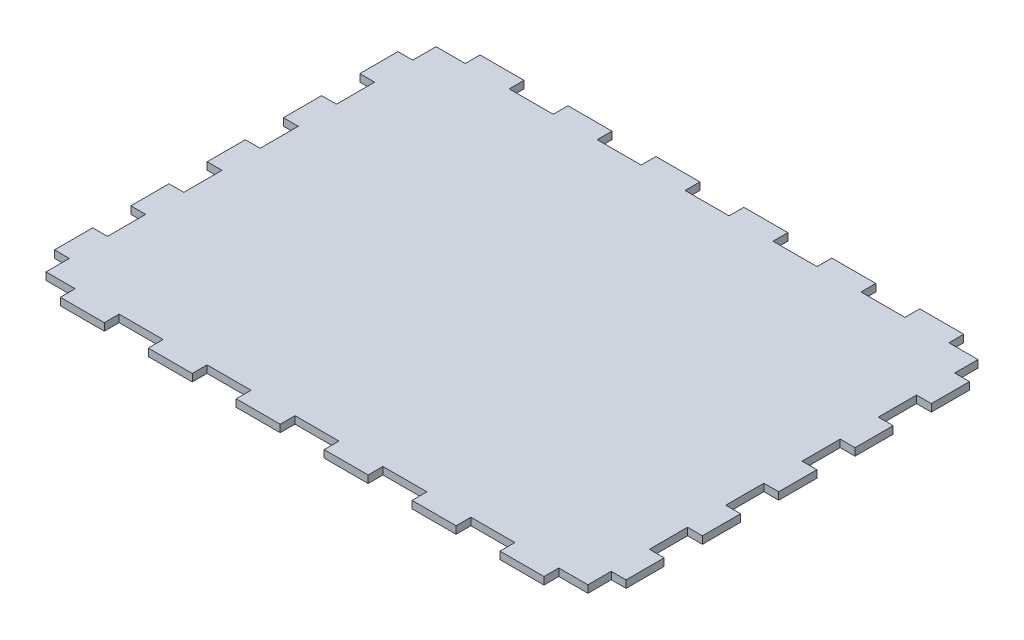
from build123d import *

# Parameters (mm, degrees)
ESBO_O1_W                = 231.5
ESBO_O1_H                = 170
RESSALTO_EXTRUS_O1_DEPTH = 3
CORTE_EXTRUS_O1_REACH    = 145.639
ESBO_O2_W                = 17.807692308
ESBO_O2_H                = 6
CORTE_EXTRUS_O2_REACH    = 145.639
ESBO_O3_W                = 6
ESBO_O3_H                = 15.454545455


with BuildPart() as part:
    # Esboço1 → Ressalto-extrusão1 (new body)
    with BuildSketch(Plane(origin=(0, 0, 0), x_dir=(1, 0, 0), z_dir=(0, 1, 0))):
        Rectangle(ESBO_O1_W, ESBO_O1_H)
    extrude(amount=RESSALTO_EXTRUS_O1_DEPTH)

    # Esboço2 → Corte-extrusão1 (cut, up to next)
    with BuildSketch(Plane.XZ, mode=Mode.PRIVATE) as corte_extrus_o1_sk1:
        with Locations((-71.226153846, 82)):
            Rectangle(ESBO_O2_W, ESBO_O2_H)
    corte_extrus_o1_tool1 = extrude(corte_extrus_o1_sk1.sketch, amount=-CORTE_EXTRUS_O1_REACH, mode=Mode.PRIVATE) & part.part
    # Esboço2 → Corte-extrusão1 (cut, up to next)
    with BuildSketch(Plane.XZ, mode=Mode.PRIVATE) as corte_extrus_o1_sk2:
        with Locations((-106.846153846, 82)):
            Rectangle(ESBO_O2_W, ESBO_O2_H)
    corte_extrus_o1_tool2 = extrude(corte_extrus_o1_sk2.sketch, amount=-CORTE_EXTRUS_O1_REACH, mode=Mode.PRIVATE) & part.part
    # Esboço2 → Corte-extrusão1 (cut, up to next)
    with BuildSketch(Plane.XZ, mode=Mode.PRIVATE) as corte_extrus_o1_sk3:
        with Locations((-35.606153846, 82)):
            Rectangle(ESBO_O2_W, ESBO_O2_H)
    corte_extrus_o1_tool3 = extrude(corte_extrus_o1_sk3.sketch, amount=-CORTE_EXTRUS_O1_REACH, mode=Mode.PRIVATE) & part.part
    # Esboço2 → Corte-extrusão1 (cut, up to next)
    with BuildSketch(Plane.XZ, mode=Mode.PRIVATE) as corte_extrus_o1_sk4:
        with Locations((0.013846154, 82)):
            Rectangle(ESBO_O2_W, ESBO_O2_H)
    corte_extrus_o1_tool4 = extrude(corte_extrus_o1_sk4.sketch, amount=-CORTE_EXTRUS_O1_REACH, mode=Mode.PRIVATE) & part.part
    # Esboço2 → Corte-extrusão1 (cut, up to next)
    with BuildSketch(Plane.XZ, mode=Mode.PRIVATE) as corte_extrus_o1_sk5:
        with Locations((35.633846154, 82)):
            Rectangle(ESBO_O2_W, ESBO_O2_H)
    corte_extrus_o1_tool5 = extrude(corte_extrus_o1_sk5.sketch, amount=-CORTE_EXTRUS_O1_REACH, mode=Mode.PRIVATE) & part.part
    # Esboço2 → Corte-extrusão1 (cut, up to next)
    with BuildSketch(Plane.XZ, mode=Mode.PRIVATE) as corte_extrus_o1_sk6:
        with Locations((71.253846154, 82)):
            Rectangle(ESBO_O2_W, ESBO_O2_H)
    corte_extrus_o1_tool6 = extrude(corte_extrus_o1_sk6.sketch, amount=-CORTE_EXTRUS_O1_REACH, mode=Mode.PRIVATE) & part.part
    # Esboço2 → Corte-extrusão1 (cut, up to next)
    with BuildSketch(Plane.XZ, mode=Mode.PRIVATE) as corte_extrus_o1_sk7:
        with Locations((106.873846154, 82)):
            Rectangle(ESBO_O2_W, ESBO_O2_H)
    corte_extrus_o1_tool7 = extrude(corte_extrus_o1_sk7.sketch, amount=-CORTE_EXTRUS_O1_REACH, mode=Mode.PRIVATE) & part.part
    # Esboço2 → Corte-extrusão1 (cut, up to next)
    with BuildSketch(Plane.XZ, mode=Mode.PRIVATE) as corte_extrus_o1_sk8:
        with Locations((-71.226153846, -82)):
            Rectangle(ESBO_O2_W, ESBO_O2_H)
    corte_extrus_o1_tool8 = extrude(corte_extrus_o1_sk8.sketch, amount=-CORTE_EXTRUS_O1_REACH, mode=Mode.PRIVATE) & part.part
    # Esboço2 → Corte-extrusão1 (cut, up to next)
    with BuildSketch(Plane.XZ, mode=Mode.PRIVATE) as corte_extrus_o1_sk9:
        with Locations((-35.606153846, -82)):
            Rectangle(ESBO_O2_W, ESBO_O2_H)
    corte_extrus_o1_tool9 = extrude(corte_extrus_o1_sk9.sketch, amount=-CORTE_EXTRUS_O1_REACH, mode=Mode.PRIVATE) & part.part
    # Esboço2 → Corte-extrusão1 (cut, up to next)
    with BuildSketch(Plane.XZ, mode=Mode.PRIVATE) as corte_extrus_o1_sk10:
        with Locations((0.013846154, -82)):
            Rectangle(ESBO_O2_W, ESBO_O2_H)
    corte_extrus_o1_tool10 = extrude(corte_extrus_o1_sk10.sketch, amount=-CORTE_EXTRUS_O1_REACH, mode=Mode.PRIVATE) & part.part
    # Esboço2 → Corte-extrusão1 (cut, up to next)
    with BuildSketch(Plane.XZ, mode=Mode.PRIVATE) as corte_extrus_o1_sk11:
        with Locations((35.633846154, -82)):
            Rectangle(ESBO_O2_W, ESBO_O2_H)
    corte_extrus_o1_tool11 = extrude(corte_extrus_o1_sk11.sketch, amount=-CORTE_EXTRUS_O1_REACH, mode=Mode.PRIVATE) & part.part
    # Esboço2 → Corte-extrusão1 (cut, up to next)
    with BuildSketch(Plane.XZ, mode=Mode.PRIVATE) as corte_extrus_o1_sk12:
        with Locations((71.253846154, -82)):
            Rectangle(ESBO_O2_W, ESBO_O2_H)
    corte_extrus_o1_tool12 = extrude(corte_extrus_o1_sk12.sketch, amount=-CORTE_EXTRUS_O1_REACH, mode=Mode.PRIVATE) & part.part
    # Esboço2 → Corte-extrusão1 (cut, up to next)
    with BuildSketch(Plane.XZ, mode=Mode.PRIVATE) as corte_extrus_o1_sk13:
        with Locations((106.873846154, -82)):
            Rectangle(ESBO_O2_W, ESBO_O2_H)
    corte_extrus_o1_tool13 = extrude(corte_extrus_o1_sk13.sketch, amount=-CORTE_EXTRUS_O1_REACH, mode=Mode.PRIVATE) & part.part
    # Esboço2 → Corte-extrusão1 (cut, up to next)
    with BuildSketch(Plane.XZ, mode=Mode.PRIVATE) as corte_extrus_o1_sk14:
        with Locations((-106.846153846, -82)):
            Rectangle(ESBO_O2_W, ESBO_O2_H)
    corte_extrus_o1_tool14 = extrude(corte_extrus_o1_sk14.sketch, amount=-CORTE_EXTRUS_O1_REACH, mode=Mode.PRIVATE) & part.part
    add(corte_extrus_o1_tool1.solids().sort_by_distance((-71.226154, 0, 82))[0], mode=Mode.SUBTRACT)
    add(corte_extrus_o1_tool2.solids().sort_by_distance((-106.846154, 0, 82))[0], mode=Mode.SUBTRACT)
    add(corte_extrus_o1_tool3.solids().sort_by_distance((-35.606154, 0, 82))[0], mode=Mode.SUBTRACT)
    add(corte_extrus_o1_tool4.solids().sort_by_distance((0.013846, 0, 82))[0], mode=Mode.SUBTRACT)
    add(corte_extrus_o1_tool5.solids().sort_by_distance((35.633846, 0, 82))[0], mode=Mode.SUBTRACT)
    add(corte_extrus_o1_tool6.solids().sort_by_distance((71.253846, 0, 82))[0], mode=Mode.SUBTRACT)
    add(corte_extrus_o1_tool7.solids().sort_by_distance((106.873846, 0, 82))[0], mode=Mode.SUBTRACT)
    add(corte_extrus_o1_tool8.solids().sort_by_distance((-71.226154, 0, -82))[0], mode=Mode.SUBTRACT)
    add(corte_extrus_o1_tool9.solids().sort_by_distance((-35.606154, 0, -82))[0], mode=Mode.SUBTRACT)
    add(corte_extrus_o1_tool10.solids().sort_by_distance((0.013846, 0, -82))[0], mode=Mode.SUBTRACT)
    add(corte_extrus_o1_tool11.solids().sort_by_distance((35.633846, 0, -82))[0], mode=Mode.SUBTRACT)
    add(corte_extrus_o1_tool12.solids().sort_by_distance((71.253846, 0, -82))[0], mode=Mode.SUBTRACT)
    add(corte_extrus_o1_tool13.solids().sort_by_distance((106.873846, 0, -82))[0], mode=Mode.SUBTRACT)
    add(corte_extrus_o1_tool14.solids().sort_by_distance((-106.846154, 0, -82))[0], mode=Mode.SUBTRACT)

    # Esboço3 → Corte-extrusão2 (cut, up to next)
    with BuildSketch(Plane.XZ, mode=Mode.PRIVATE) as corte_extrus_o2_sk1:
        with Locations((112.75, 77.272727272)):
            Rectangle(ESBO_O3_W, ESBO_O3_H)
    corte_extrus_o2_tool1 = extrude(corte_extrus_o2_sk1.sketch, amount=-CORTE_EXTRUS_O2_REACH, mode=Mode.PRIVATE) & part.part
    # Esboço3 → Corte-extrusão2 (cut, up to next)
    with BuildSketch(Plane.XZ, mode=Mode.PRIVATE) as corte_extrus_o2_sk2:
        with Locations((-112.75, 77.272727272)):
            Rectangle(ESBO_O3_W, ESBO_O3_H)
    corte_extrus_o2_tool2 = extrude(corte_extrus_o2_sk2.sketch, amount=-CORTE_EXTRUS_O2_REACH, mode=Mode.PRIVATE) & part.part
    # Esboço3 → Corte-extrusão2 (cut, up to next)
    with BuildSketch(Plane.XZ, mode=Mode.PRIVATE) as corte_extrus_o2_sk3:
        with Locations((112.75, 46.362727273)):
            Rectangle(ESBO_O3_W, ESBO_O3_H)
    corte_extrus_o2_tool3 = extrude(corte_extrus_o2_sk3.sketch, amount=-CORTE_EXTRUS_O2_REACH, mode=Mode.PRIVATE) & part.part
    # Esboço3 → Corte-extrusão2 (cut, up to next)
    with BuildSketch(Plane.XZ, mode=Mode.PRIVATE) as corte_extrus_o2_sk4:
        with Locations((112.75, 15.452727273)):
            Rectangle(ESBO_O3_W, ESBO_O3_H)
    corte_extrus_o2_tool4 = extrude(corte_extrus_o2_sk4.sketch, amount=-CORTE_EXTRUS_O2_REACH, mode=Mode.PRIVATE) & part.part
    # Esboço3 → Corte-extrusão2 (cut, up to next)
    with BuildSketch(Plane.XZ, mode=Mode.PRIVATE) as corte_extrus_o2_sk5:
        with Locations((112.75, -15.457272728)):
            Rectangle(ESBO_O3_W, ESBO_O3_H)
    corte_extrus_o2_tool5 = extrude(corte_extrus_o2_sk5.sketch, amount=-CORTE_EXTRUS_O2_REACH, mode=Mode.PRIVATE) & part.part
    # Esboço3 → Corte-extrusão2 (cut, up to next)
    with BuildSketch(Plane.XZ, mode=Mode.PRIVATE) as corte_extrus_o2_sk6:
        with Locations((112.75, -46.367272728)):
            Rectangle(ESBO_O3_W, ESBO_O3_H)
    corte_extrus_o2_tool6 = extrude(corte_extrus_o2_sk6.sketch, amount=-CORTE_EXTRUS_O2_REACH, mode=Mode.PRIVATE) & part.part
    # Esboço3 → Corte-extrusão2 (cut, up to next)
    with BuildSketch(Plane.XZ, mode=Mode.PRIVATE) as corte_extrus_o2_sk7:
        with Locations((112.75, -77.277272728)):
            Rectangle(ESBO_O3_W, ESBO_O3_H)
    corte_extrus_o2_tool7 = extrude(corte_extrus_o2_sk7.sketch, amount=-CORTE_EXTRUS_O2_REACH, mode=Mode.PRIVATE) & part.part
    # Esboço3 → Corte-extrusão2 (cut, up to next)
    with BuildSketch(Plane.XZ, mode=Mode.PRIVATE) as corte_extrus_o2_sk8:
        with Locations((-112.75, 46.362727273)):
            Rectangle(ESBO_O3_W, ESBO_O3_H)
    corte_extrus_o2_tool8 = extrude(corte_extrus_o2_sk8.sketch, amount=-CORTE_EXTRUS_O2_REACH, mode=Mode.PRIVATE) & part.part
    # Esboço3 → Corte-extrusão2 (cut, up to next)
    with BuildSketch(Plane.XZ, mode=Mode.PRIVATE) as corte_extrus_o2_sk9:
        with Locations((-112.75, 15.452727273)):
            Rectangle(ESBO_O3_W, ESBO_O3_H)
    corte_extrus_o2_tool9 = extrude(corte_extrus_o2_sk9.sketch, amount=-CORTE_EXTRUS_O2_REACH, mode=Mode.PRIVATE) & part.part
    # Esboço3 → Corte-extrusão2 (cut, up to next)
    with BuildSketch(Plane.XZ, mode=Mode.PRIVATE) as corte_extrus_o2_sk10:
        with Locations((-112.75, -15.457272728)):
            Rectangle(ESBO_O3_W, ESBO_O3_H)
    corte_extrus_o2_tool10 = extrude(corte_extrus_o2_sk10.sketch, amount=-CORTE_EXTRUS_O2_REACH, mode=Mode.PRIVATE) & part.part
    # Esboço3 → Corte-extrusão2 (cut, up to next)
    with BuildSketch(Plane.XZ, mode=Mode.PRIVATE) as corte_extrus_o2_sk11:
        with Locations((-112.75, -46.367272728)):
            Rectangle(ESBO_O3_W, ESBO_O3_H)
    corte_extrus_o2_tool11 = extrude(corte_extrus_o2_sk11.sketch, amount=-CORTE_EXTRUS_O2_REACH, mode=Mode.PRIVATE) & part.part
    # Esboço3 → Corte-extrusão2 (cut, up to next)
    with BuildSketch(Plane.XZ, mode=Mode.PRIVATE) as corte_extrus_o2_sk12:
        with Locations((-112.75, -77.277272728)):
            Rectangle(ESBO_O3_W, ESBO_O3_H)
    corte_extrus_o2_tool12 = extrude(corte_extrus_o2_sk12.sketch, amount=-CORTE_EXTRUS_O2_REACH, mode=Mode.PRIVATE) & part.part
    add(corte_extrus_o2_tool1.solids().sort_by_distance((112.75, 0, 77.272727))[0], mode=Mode.SUBTRACT)
    add(corte_extrus_o2_tool2.solids().sort_by_distance((-112.75, 0, 77.272727))[0], mode=Mode.SUBTRACT)
    add(corte_extrus_o2_tool3.solids().sort_by_distance((112.75, 0, 46.362727))[0], mode=Mode.SUBTRACT)
    add(corte_extrus_o2_tool4.solids().sort_by_distance((112.75, 0, 15.452727))[0], mode=Mode.SUBTRACT)
    add(corte_extrus_o2_tool5.solids().sort_by_distance((112.75, 0, -15.457273))[0], mode=Mode.SUBTRACT)
    add(corte_extrus_o2_tool6.solids().sort_by_distance((112.75, 0, -46.367273))[0], mode=Mode.SUBTRACT)
    add(corte_extrus_o2_tool7.solids().sort_by_distance((112.75, 0, -77.277273))[0], mode=Mode.SUBTRACT)
    add(corte_extrus_o2_tool8.solids().sort_by_distance((-112.75, 0, 46.362727))[0], mode=Mode.SUBTRACT)
    add(corte_extrus_o2_tool9.solids().sort_by_distance((-112.75, 0, 15.452727))[0], mode=Mode.SUBTRACT)
    add(corte_extrus_o2_tool10.solids().sort_by_distance((-112.75, 0, -15.457273))[0], mode=Mode.SUBTRACT)
    add(corte_extrus_o2_tool11.solids().sort_by_distance((-112.75, 0, -46.367273))[0], mode=Mode.SUBTRACT)
    add(corte_extrus_o2_tool12.solids().sort_by_distance((-112.75, 0, -77.277273))[0], mode=Mode.SUBTRACT)


solid = part.part
